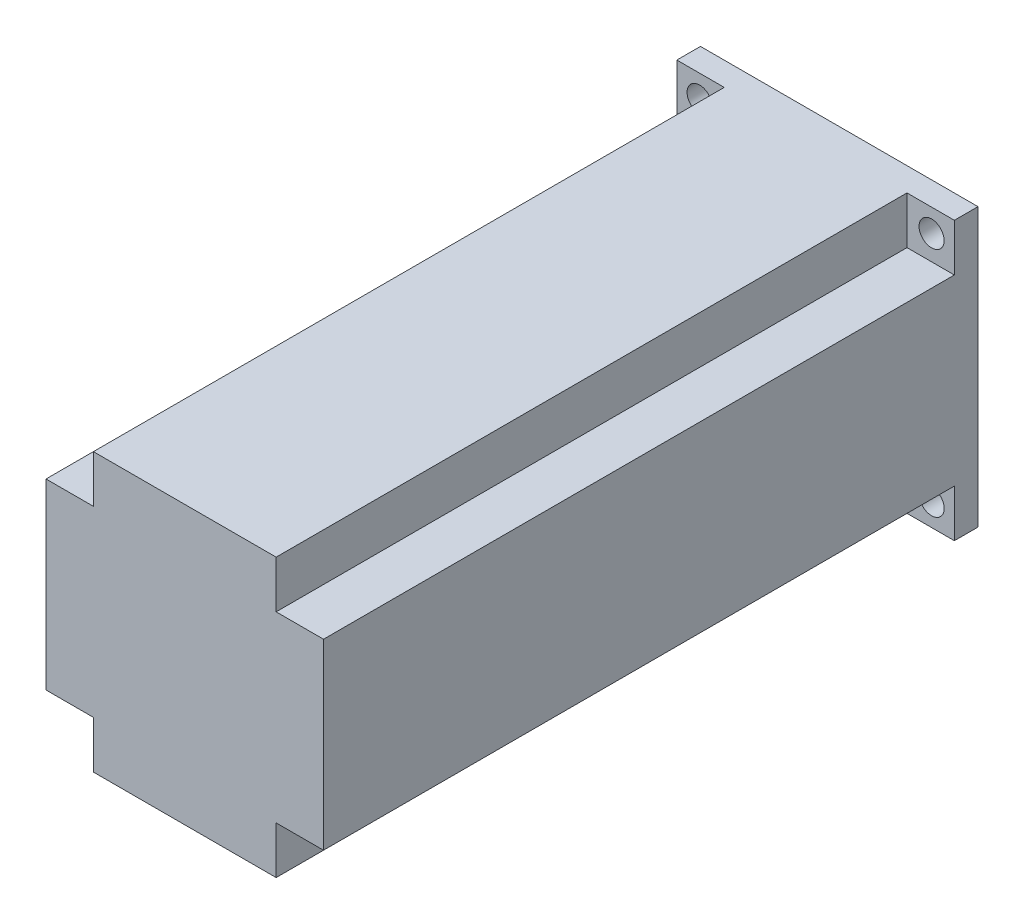
from build123d import *

# Parameters (mm, degrees)
SKETCH_1_W          = 56.4
SKETCH_1_H          = 56.4
SKETCH_1_R          = 2.55
EXTRUDE_1_DEPTH     = 133
CUT_EXTRUDE_START   = -128.2
SKETCH_2_W          = 9.63
SKETCH_2_H          = 9.63
SKETCH_2_R          = 2.55
SKETCH_2_W_2        = 10
SKETCH_2_H_2        = 10
CUT_EXTRUDE_1_DEPTH = 128.2
SKETCH_3_R          = 4
EXTRUDE_2_DEPTH     = 20.6
SKETCH_4_R          = 19.05
EXTRUDE_3_DEPTH     = 1.6


with BuildPart() as part:
    # 草图1 → 凸台-拉伸1 (new body)
    with BuildSketch(Plane.XY):
        Rectangle(SKETCH_1_W, SKETCH_1_H)
        with Locations((23.57, 23.57)):
            Circle(SKETCH_1_R, mode=Mode.SUBTRACT)
        with Locations((23.57, -23.57)):
            Circle(SKETCH_1_R, mode=Mode.SUBTRACT)
        with Locations((-23.57, -23.57)):
            Circle(SKETCH_1_R, mode=Mode.SUBTRACT)
        with Locations((-23.57, 23.57)):
            Circle(SKETCH_1_R, mode=Mode.SUBTRACT)
    extrude(amount=EXTRUDE_1_DEPTH)

    # 草图2 → 切除-拉伸1 (cut)
    # profile 1 of 4: a face of its own
    with BuildSketch(Plane.XY.offset(133).offset(CUT_EXTRUDE_START)):
        with Locations((-23.385, -23.385)):
            Rectangle(SKETCH_2_W, SKETCH_2_H)
        with Locations((-23.57, -23.57)):
            Circle(SKETCH_2_R, mode=Mode.SUBTRACT)
    # profile 2 of 4: a face of its own
    with BuildSketch(Plane.XY.offset(133).offset(CUT_EXTRUDE_START)):
        with Locations((23.385, -23.385)):
            Rectangle(SKETCH_2_W, SKETCH_2_H)
        with Locations((23.57, -23.57)):
            Circle(SKETCH_2_R, mode=Mode.SUBTRACT)
    # profile 3 of 4: a face of its own
    with BuildSketch(Plane.XY.offset(133).offset(CUT_EXTRUDE_START)):
        with Locations((23.385, 23.385)):
            Rectangle(SKETCH_2_W, SKETCH_2_H)
        with Locations((23.57, 23.57)):
            Circle(SKETCH_2_R, mode=Mode.SUBTRACT)
    # profile 4 of 4: a face of its own
    with BuildSketch(Plane.XY.offset(133).offset(CUT_EXTRUDE_START)):
        with Locations((-23.57, 23.57)):
            Rectangle(SKETCH_2_W_2, SKETCH_2_H_2)
    extrude(amount=CUT_EXTRUDE_1_DEPTH, mode=Mode.SUBTRACT)

    # 草图3 → 凸台-拉伸2 (add)
    with BuildSketch(Plane(origin=(0, 0, 0), x_dir=(-1, 0, 0), z_dir=(0, 0, -1))):
        with Locations(Location((0, 0, 0), (0, 0, 180))):
            Circle(SKETCH_3_R)
    extrude(amount=EXTRUDE_2_DEPTH)

    # 草图4 → 凸台-拉伸3 (add)
    with BuildSketch(Plane(origin=(0, 0, 0), x_dir=(-1, 0, 0), z_dir=(0, 0, -1))):
        with Locations(Location((0, 0, 0), (0, 0, 180))):
            Circle(SKETCH_4_R)
    extrude(amount=EXTRUDE_3_DEPTH)


solid = part.part
